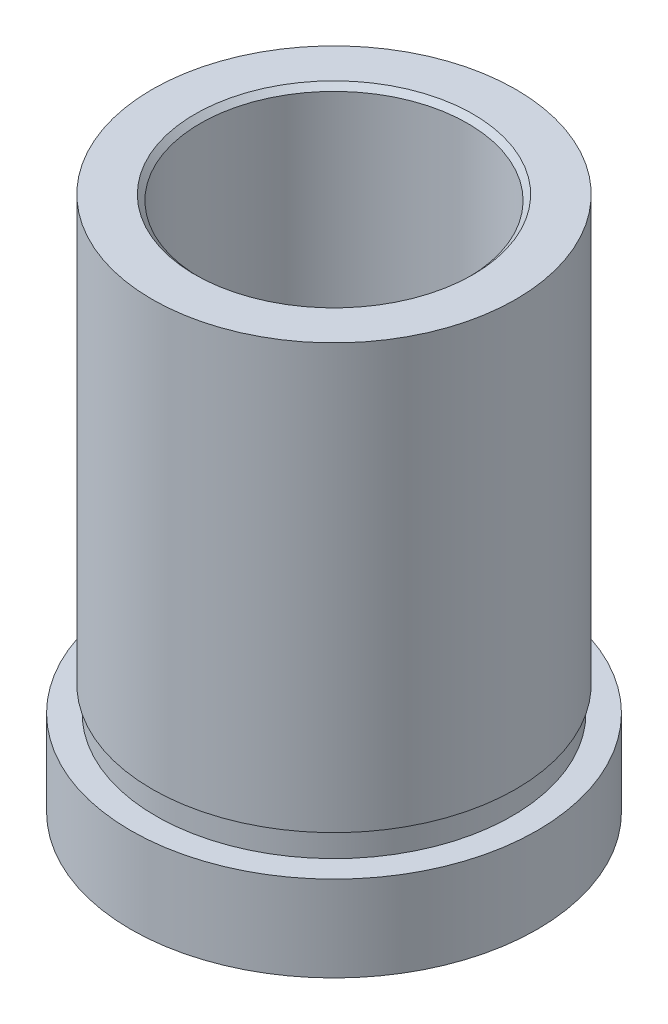
from build123d import *

# Parameters (mm, degrees)
CUT_EXTRUDE1_DEPTH      = 57.762663785
CUT_EXTRUDE1_DEPTH_BACK = 57.762663785
SKETCH2_R               = 12.5
SKETCH4_R               = 12.6
CUT_EXTRUDE2_DEPTH      = 16
CHAMFER4_SIZE           = 0.5
CHAMFER5_SIZE           = 0.5


with BuildPart() as part:
    # Sketch1 → Revolve1 (revolve)
    with BuildSketch(Plane.XY, mode=Mode.PRIVATE) as revolve1_sk:
        Polygon((0, 0), (19, 0), (19, 8), (16.65, 8), (16.65, 10.35), (17, 10.35), (17, 50), (0, 50), align=None)
    revolve(revolve1_sk.sketch.rotate(Axis((0, 50, 0), (0, -1, 0)), 180), axis=Axis((0, 50, 0), (0, -1, 0)))

    # Sketch2 → Cut-Extrude1 (cut, two sides: drawn at the far end of the back side and taken through both)
    with BuildSketch(Plane.XZ.offset(-CUT_EXTRUDE1_DEPTH_BACK)):
        Circle(SKETCH2_R)
    extrude(amount=CUT_EXTRUDE1_DEPTH + CUT_EXTRUDE1_DEPTH_BACK, mode=Mode.SUBTRACT)

    # Sketch4 → Cut-Extrude2 (cut)
    with BuildSketch(Plane.XZ):
        Circle(SKETCH4_R)
    extrude(amount=-CUT_EXTRUDE2_DEPTH, mode=Mode.SUBTRACT)

    # Chamfer4
    chamfer4_edges = [part.edges().sort_by_distance(p)[0] for p in [
        (-12.6, 0, 0),
    ]]
    chamfer(chamfer4_edges, length=CHAMFER4_SIZE)

    # Chamfer5
    chamfer5_edges = [part.edges().sort_by_distance(p)[0] for p in [
        (-12.5, 50, 0),
    ]]
    chamfer(chamfer5_edges, length=CHAMFER5_SIZE)


solid = part.part
